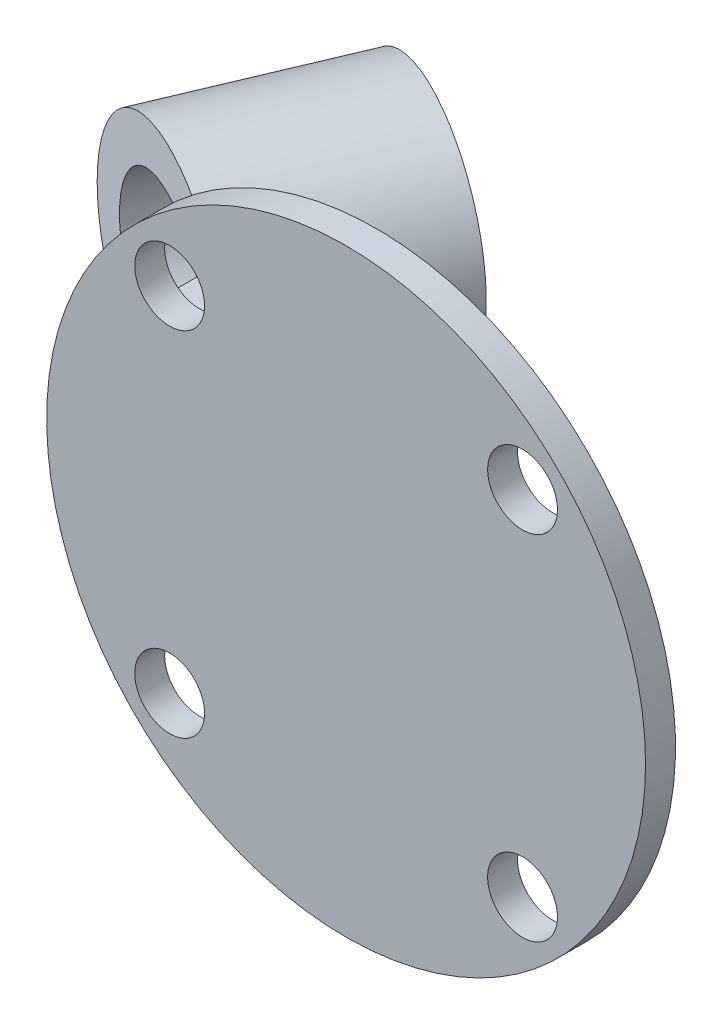
from build123d import *

# Parameters (mm, degrees)
SKETCH_2_R          = 30
EXTRUDE_1_DEPTH     = 3
SKETCH_3_R          = 3.5
CUT_EXTRUDE_1_DEPTH = 3
EXTRUDE_2_DEPTH     = 5


with BuildPart() as part:
    # 草图2 → 凸台-拉伸1 (new body)
    with BuildSketch(Plane.XY):
        Circle(SKETCH_2_R)
    extrude(amount=EXTRUDE_1_DEPTH)

    # 草图3 → 切除-拉伸1 (cut)
    with BuildSketch(Plane.XY.offset(3)):
        with Locations((-17.67766953, 17.67766953)):
            Circle(SKETCH_3_R)
        with Locations(Location((17.67766953, 17.67766953, 0), (0, 0, 180))):
            Circle(SKETCH_3_R)
        with Locations((17.67766953, -17.67766953)):
            Circle(SKETCH_3_R)
        with Locations(Location((-17.67766953, -17.67766953, 0), (0, 0, 180))):
            Circle(SKETCH_3_R)
    extrude(amount=-CUT_EXTRUDE_1_DEPTH, mode=Mode.SUBTRACT)



with BuildPart() as body_2:
    # 草图25 → 旋转2 (revolve)
    with BuildSketch(Plane(origin=(0, 0, 0), x_dir=(1, 0, 0), z_dir=(0, 1, 0)), mode=Mode.PRIVATE) as revolve_2_sk:
        Polygon((-29.758424065, 12.360243347), (-25.889028477, 10.726910013), (-18.111250699, 29.152603293), (-21.478005352, 30.573763904), align=None)
    revolve(revolve_2_sk.sketch.rotate(Axis((-35, 0, -20), (-0.3888888888888914, 0, 0.92128466398761)), 180), axis=Axis((-35, 0, -20), (-0.3888888888888914, 0, 0.92128466398761)))


with BuildPart() as part_1:
    add(part.part)

    add(body_2.part)  # 凸台-拉伸2 merges body 2
    # 草图26 → 凸台-拉伸2 (add, symmetric)
    with BuildSketch(Plane(origin=(0, 0, 0), x_dir=(1, 0, 0), z_dir=(0, 1, 0))):
        Polygon((-29.758424065, 12.360243347), (-29.758424065, 0), (0, 0), (-23.944584032, 15.333333333), (-27.159925438, 16.690580008), align=None)
    extrude(amount=EXTRUDE_2_DEPTH, both=True)


solid = part_1.part
